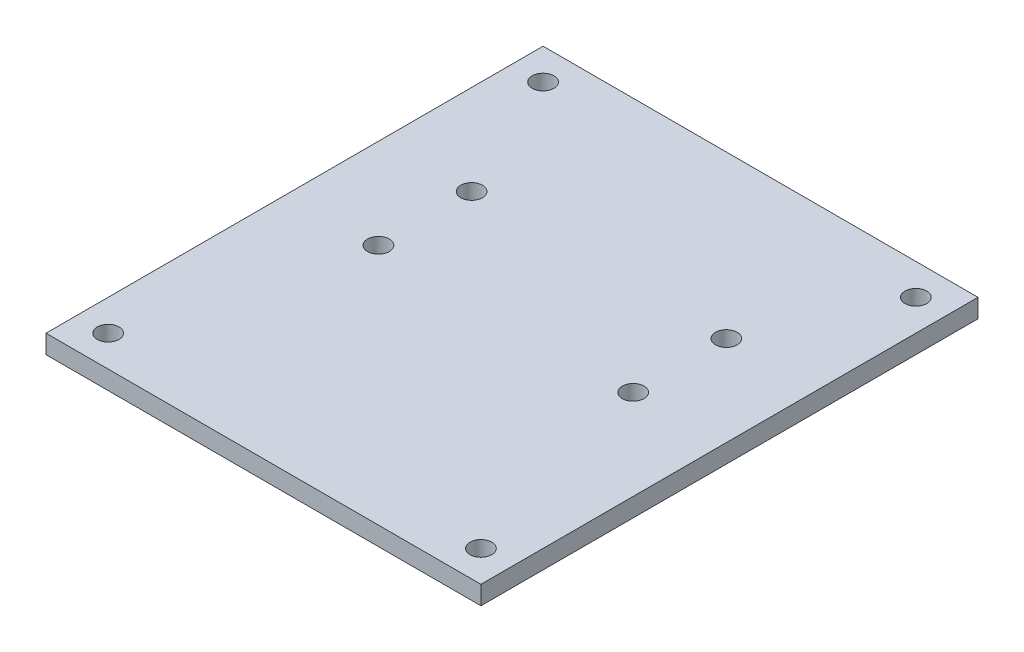
from build123d import *

# Parameters (mm, degrees)
SKETCH1_W           = 70
SKETCH1_H           = 80
SKETCH1_R           = 1.75
BOSS_EXTRUDE1_DEPTH = 3
SKETCH2_R           = 1.75
CUT_EXTRUDE1_DEPTH  = 3


with BuildPart() as part:
    # Sketch1 → Boss-Extrude1 (new body)
    with BuildSketch(Plane(origin=(0, 0, 0), x_dir=(1, 0, 0), z_dir=(0, 1, 0))):
        with Locations((0, -6.5)):
            Rectangle(SKETCH1_W, SKETCH1_H)
        with Locations(Location((-20.5, 7.5, 0), (0, 0, 270))):
            Circle(SKETCH1_R, mode=Mode.SUBTRACT)
        with Locations(Location((-20.5, -7.5, 0), (0, 0, 90))):
            Circle(SKETCH1_R, mode=Mode.SUBTRACT)
        with Locations(Location((20.5, -7.5, 0), (0, 0, 270))):
            Circle(SKETCH1_R, mode=Mode.SUBTRACT)
        with Locations(Location((20.5, 7.5, 0), (0, 0, 90))):
            Circle(SKETCH1_R, mode=Mode.SUBTRACT)
    extrude(amount=BOSS_EXTRUDE1_DEPTH)

    # Sketch2 → Cut-Extrude1 (cut)
    with BuildSketch(Plane(origin=(0, 3, 0), x_dir=(1, 0, 0), z_dir=(0, 1, 0))):
        with Locations(Location((30, 28.5, 0), (0, 0, 270))):
            Circle(SKETCH2_R)
        with Locations(Location((-30, 28.5, 0), (0, 0, 90))):
            Circle(SKETCH2_R)
        with Locations(Location((30, -41.5, 0), (0, 0, 90))):
            Circle(SKETCH2_R)
        with Locations(Location((-30, -41.5, 0), (0, 0, 270))):
            Circle(SKETCH2_R)
    extrude(amount=-CUT_EXTRUDE1_DEPTH, mode=Mode.SUBTRACT)


solid = part.part
